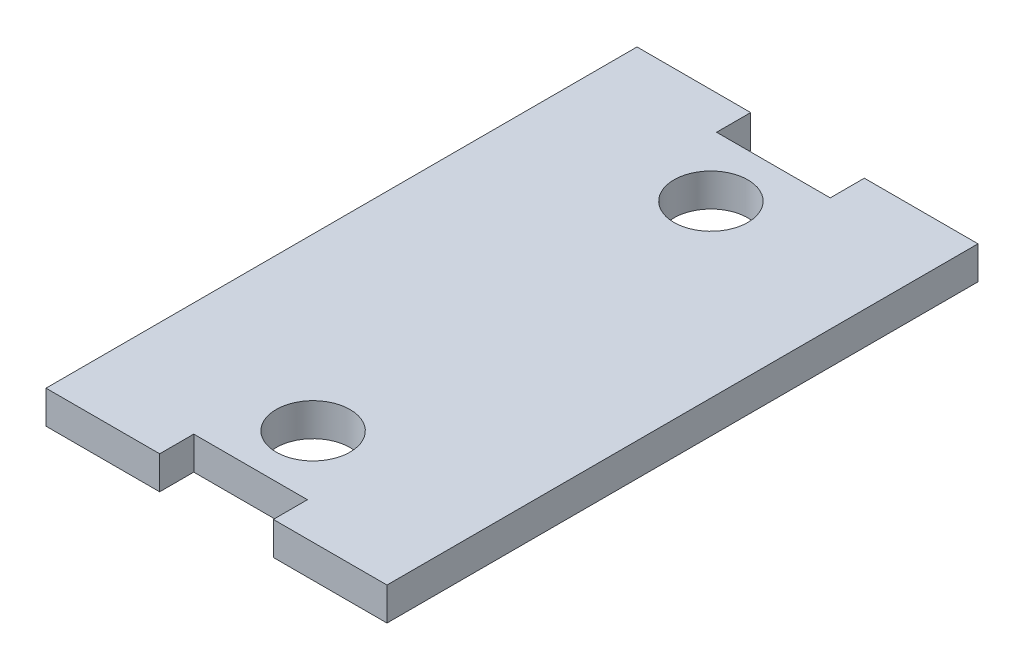
from build123d import *

# Parameters (mm, degrees)
SKETCH1_R           = 1.625
BOSS_EXTRUDE1_DEPTH = 1.45


with BuildPart() as part:
    # Sketch1 → Boss-Extrude1 (new body)
    with BuildSketch(Plane(origin=(0, 0, 0), x_dir=(1, 0, 0), z_dir=(0, 1, 0))):
        Polygon((-7.5, 13), (-2.5, 13), (-2.5, 11.5), (2.5, 11.5), (2.5, 13), (7.5, 13), (7.5, -13), (2.5, -13), (2.5, -11.5), (-2.5, -11.5), (-2.5, -13), (-7.5, -13), align=None)
        with Locations(Location((0, 8.75, 0), (0, 0, 270))):
            Circle(SKETCH1_R, mode=Mode.SUBTRACT)
        with Locations(Location((0, -8.75, 0), (0, 0, 90))):
            Circle(SKETCH1_R, mode=Mode.SUBTRACT)
    extrude(amount=BOSS_EXTRUDE1_DEPTH)


solid = part.part
